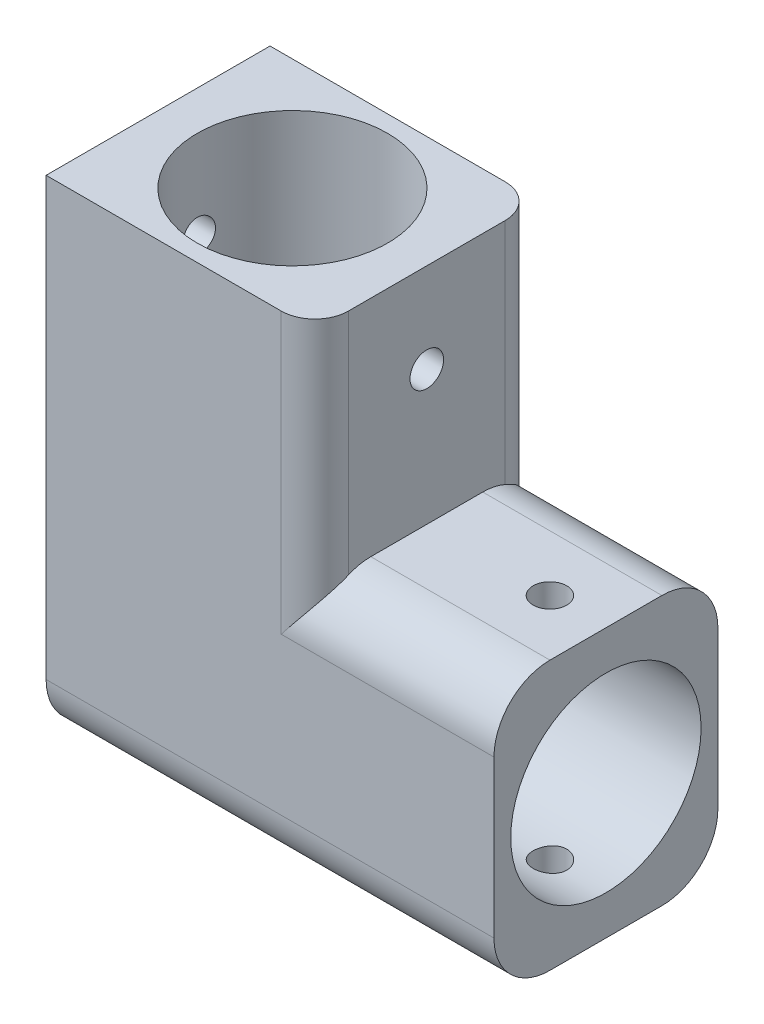
from build123d import *

# Parameters (mm, degrees)
CROQUIS1_W              = 40
CROQUIS1_H              = 24
CROQUIS1_W_2            = 24
CROQUIS1_H_2            = 20
SALIENTE_EXTRUIR1_DEPTH = 10
CROQUIS3_R              = 8.5
CORTAR_EXTRUIR1_DEPTH   = 70
CROQUIS4_R              = 8.5
CORTAR_EXTRUIR2_DEPTH   = 18
CROQUIS5_R              = 1.5
CORTAR_EXTRUIR3_DEPTH   = 25
CROQUIS6_R              = 1.5
CORTAR_EXTRUIR4_DEPTH   = 30
REDONDEO1_R             = 5
REDONDEO2_R             = 3


with BuildPart() as part:
    # Croquis1 → Saliente-Extruir1 (new, symmetric)
    with BuildSketch(Plane.XY):
        Rectangle(CROQUIS1_W, CROQUIS1_H)
        with Locations((-8, 22)):
            Rectangle(CROQUIS1_W_2, CROQUIS1_H_2)
    extrude(amount=SALIENTE_EXTRUIR1_DEPTH, both=True)

    # Croquis3 → Cortar-Extruir1 (cut)
    with BuildSketch(Plane(origin=(20, 0, 0), x_dir=(0, 0, -1), z_dir=(1, 0, 0))):
        Circle(CROQUIS3_R)
    extrude(amount=-CORTAR_EXTRUIR1_DEPTH, mode=Mode.SUBTRACT)

    # Croquis4 → Cortar-Extruir2 (cut)
    with BuildSketch(Plane(origin=(0, 32, 0), x_dir=(1, 0, 0), z_dir=(0, 1, 0))):
        with Locations(Location((-8, 0, 0), (0, 0, 270))):
            Circle(CROQUIS4_R)
    extrude(amount=-CORTAR_EXTRUIR2_DEPTH, mode=Mode.SUBTRACT)

    # Croquis5 → Cortar-Extruir3 (cut)
    with BuildSketch(Plane.XZ.offset(12)):
        with Locations(Location((-15, 0, 0), (0, 0, 270))):
            Circle(CROQUIS5_R)
        with Locations(Location((15, 0, 0), (0, 0, 270))):
            Circle(CROQUIS5_R)
    extrude(amount=-CORTAR_EXTRUIR3_DEPTH, mode=Mode.SUBTRACT)

    # Croquis6 → Cortar-Extruir4 (cut)
    with BuildSketch(Plane.ZY.offset(20)):
        with Locations(Location((0, 24, 0), (0, 0, 270))):
            Circle(CROQUIS6_R)
    extrude(amount=-CORTAR_EXTRUIR4_DEPTH, mode=Mode.SUBTRACT)

    # Redondeo1
    redondeo1_edges = [part.edges().sort_by_distance(p)[0] for p in [
        (0, -12, -10),
        (12, 12, 10),
        (0, -12, 10),
        (12, 12, -10),
    ]]
    fillet(redondeo1_edges, radius=REDONDEO1_R)

    # Redondeo2
    redondeo2_edges = [part.edges().sort_by_distance(p)[0] for p in [
        (4, 19.5, 10),
        (4, 19.5, -10),
    ]]
    fillet(redondeo2_edges, radius=REDONDEO2_R)


solid = part.part
